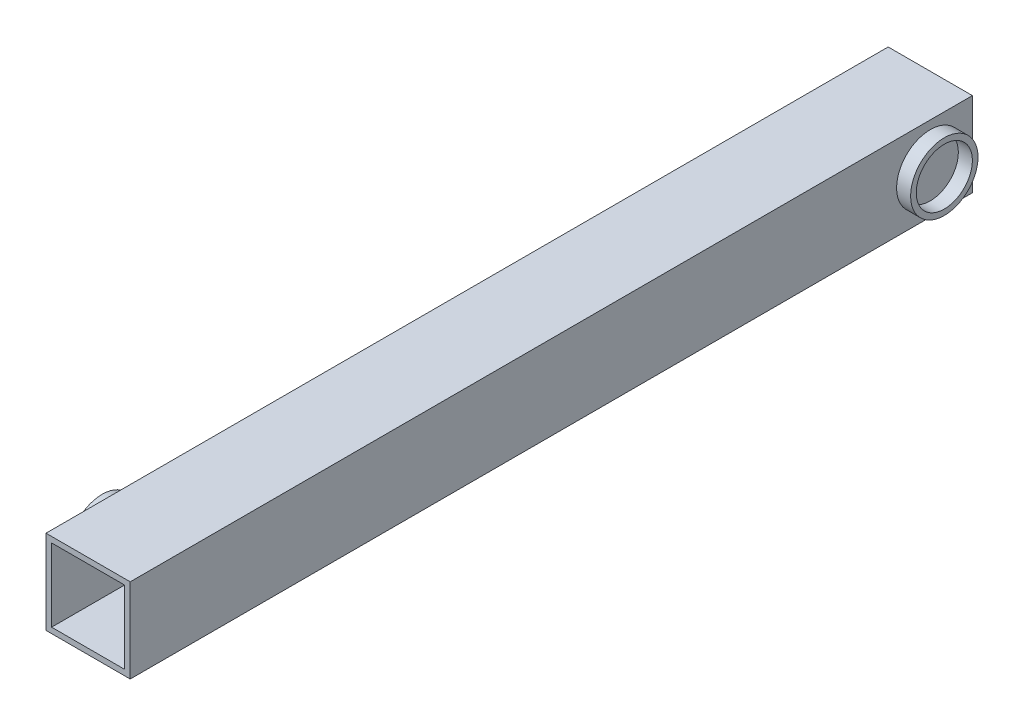
from build123d import *

# Parameters (mm, degrees)
SKETCH1_W           = 30
SKETCH1_H           = 30
SKETCH1_W_2         = 26
SKETCH1_H_2         = 26
BOSS_EXTRUDE1_DEPTH = 300
SKETCH2_R           = 12
SKETCH2_R_2         = 10
BOSS_EXTRUDE2_DEPTH = 5
SKETCH3_R           = 12
SKETCH3_R_2         = 10
BOSS_EXTRUDE3_DEPTH = 5


with BuildPart() as part:
    # Sketch1 → Boss-Extrude1 (new body)
    with BuildSketch(Plane.XY):
        Rectangle(SKETCH1_W, SKETCH1_H)
        Rectangle(SKETCH1_W_2, SKETCH1_H_2, mode=Mode.SUBTRACT)
    extrude(amount=BOSS_EXTRUDE1_DEPTH)

    # Sketch2 → Boss-Extrude2 (add)
    with BuildSketch(Plane(origin=(15, 0, 0), x_dir=(0, 0, -1), z_dir=(1, 0, 0))):
        with Locations(Location((-15, 0, 0), (0, 0, 180))):
            Circle(SKETCH2_R)
        with Locations((-15, 0)):
            Circle(SKETCH2_R_2, mode=Mode.SUBTRACT)
    extrude(amount=BOSS_EXTRUDE2_DEPTH)

    # Sketch3 → Boss-Extrude3 (add)
    with BuildSketch(Plane.ZY.offset(15)):
        with Locations(Location((275, 0, 0), (0, 0, 180))):
            Circle(SKETCH3_R)
        with Locations((275, 0)):
            Circle(SKETCH3_R_2, mode=Mode.SUBTRACT)
    extrude(amount=BOSS_EXTRUDE3_DEPTH)


solid = part.part
